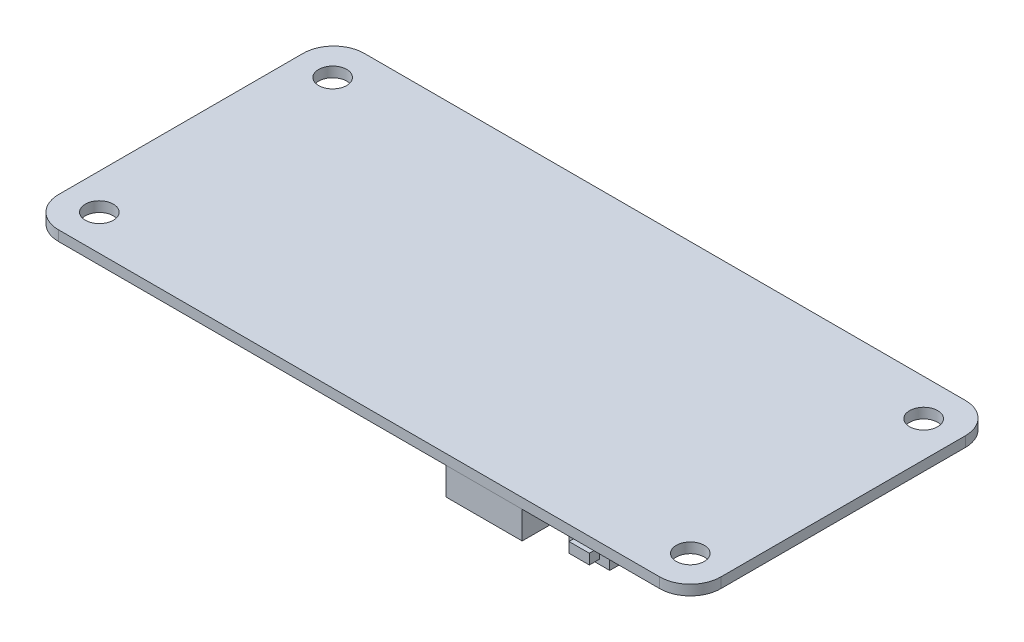
from build123d import *

# Parameters (mm, degrees)
SKETCH_1_R      = 1.375
EXTRUDE_2_DEPTH = 1
SKETCH_3_W      = 7.5
SKETCH_3_H      = 3.992889191
EXTRUDE_3_DEPTH = 2.7
SKETCH_4_W      = 4
SKETCH_4_H      = 2.408214145
EXTRUDE_4_DEPTH = 2
SKETCH_5_W      = 2
SKETCH_5_H      = 1
EXTRUDE_5_DEPTH = 1


with BuildPart() as part:
    # 草图1 → 凸台-拉伸2 (new body)
    with BuildSketch(Plane(origin=(0, 0, 0), x_dir=(1, 0, 0), z_dir=(0, 1, 0))):
        with BuildLine():
            Line((-32.5, 12), (-32.5, -12))
            ThreePointArc((-32.5, -12), (-31.621320344, -14.121320344), (-29.5, -15))
            Line((-29.5, -15), (29.5, -15))
            ThreePointArc((29.5, -15), (31.621320344, -14.121320344), (32.5, -12))
            Line((32.5, -12), (32.5, 12))
            ThreePointArc((32.5, 12), (31.621320344, 14.121320344), (29.5, 15))
            Line((29.5, 15), (-29.5, 15))
            ThreePointArc((-29.5, 15), (-31.621320344, 14.121320344), (-32.5, 12))
        make_face()
        with Locations(Location((29, 11.4, 0), (0, 0, 270))):
            Circle(SKETCH_1_R, mode=Mode.SUBTRACT)
        with Locations(Location((29, -11.5, 0), (0, 0, 270))):
            Circle(SKETCH_1_R, mode=Mode.SUBTRACT)
        with Locations(Location((-29, -11.5, 0), (0, 0, 270))):
            Circle(SKETCH_1_R, mode=Mode.SUBTRACT)
        with Locations(Location((-29, 11.4, 0), (0, 0, 270))):
            Circle(SKETCH_1_R, mode=Mode.SUBTRACT)
    extrude(amount=EXTRUDE_2_DEPTH)


with BuildPart() as body_2:
    # 草图3 → 凸台-拉伸3 (new body)
    with BuildSketch(Plane(origin=(0, 0, 0), x_dir=(1, 0, 0), z_dir=(0, 1, 0))):
        with Locations((12.25, -13.003555405)):
            Rectangle(SKETCH_3_W, SKETCH_3_H)
    extrude(amount=-EXTRUDE_3_DEPTH)


with BuildPart() as body_3:
    # 草图4 → 凸台-拉伸4 (new body)
    with BuildSketch(Plane(origin=(0, 0, 0), x_dir=(1, 0, 0), z_dir=(0, 1, 0))):
        with Locations((21.5, -12.704107073)):
            Rectangle(SKETCH_4_W, SKETCH_4_H)
    extrude(amount=-EXTRUDE_4_DEPTH)

    # 草图5 → 凸台-拉伸5 (add)
    with BuildSketch(Plane.XY.offset(13.908214145)):
        with Locations((21.5, -1.035773925)):
            Rectangle(SKETCH_5_W, SKETCH_5_H)
    extrude(amount=EXTRUDE_5_DEPTH)


solid = Compound([part.part, body_2.part, body_3.part])
